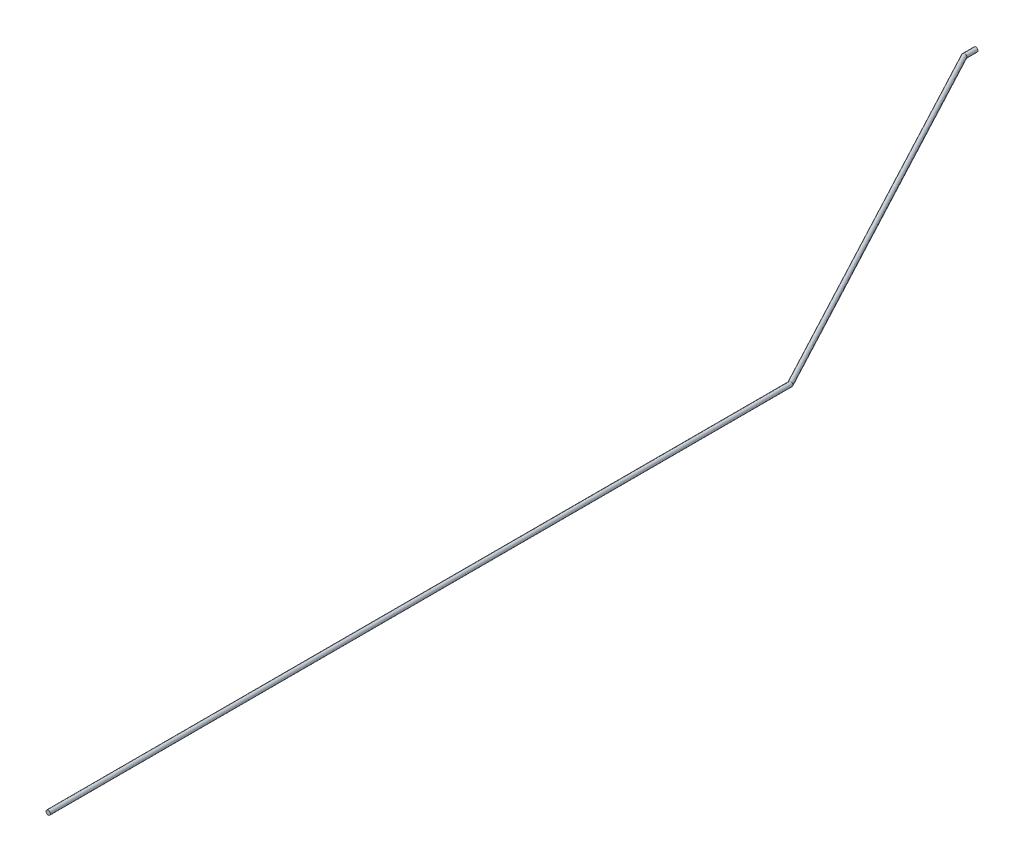
from build123d import *

# Parameters (mm, degrees)
SKETCH2_R = 2.38125


with BuildPart() as part:
    # Sweep1: sweep along a path in Sketch1
    with BuildLine(Plane(origin=(0, 0, 0), x_dir=(1, 0, 0), z_dir=(0, 1, 0))) as sweep1_path:
        Line((0, 0), (0, 812.8))
        Line((0, 812.8), (-215.9, 1219.2))
        Line((-215.9, 1219.2), (-215.9, 1231.9))
    # Sketch2 → Sweep1 (sweep)
    with BuildSketch(Plane.XY):
        Circle(SKETCH2_R)
    sweep(path=sweep1_path.line, transition=Transition.RIGHT)


solid = part.part
